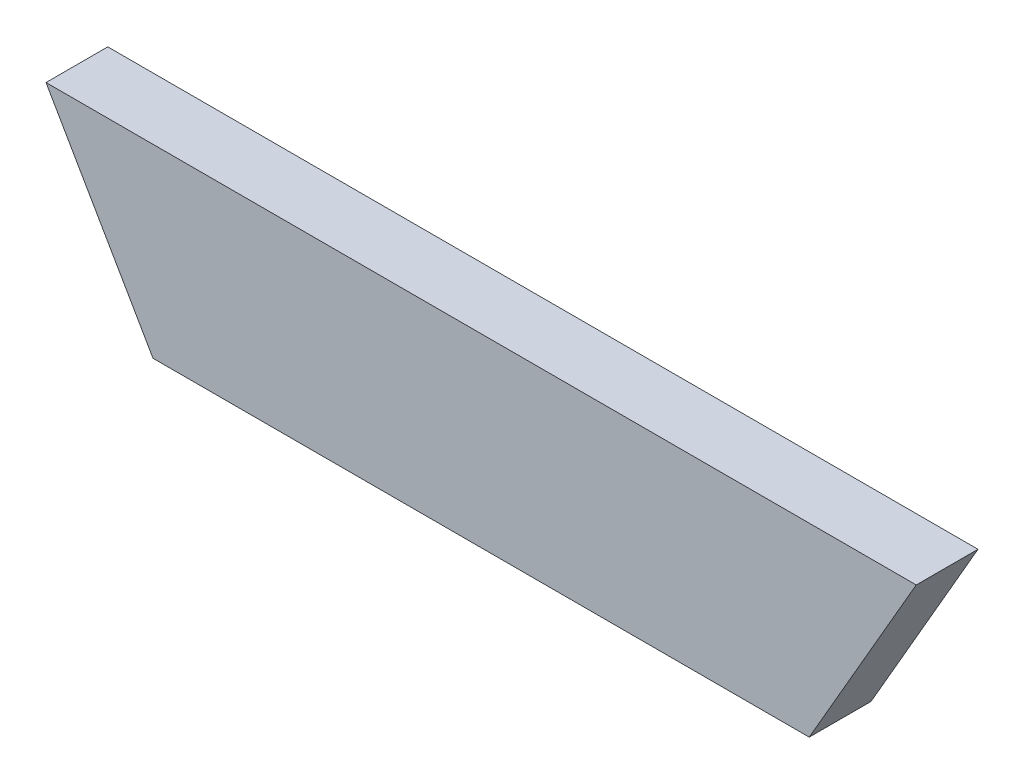
from build123d import *

# Parameters (mm, degrees)
BOSS_EXTRU_1_DEPTH = 15


with BuildPart() as part:
    # Esquisse1 → Boss.-Extru.1 (new body)
    with BuildSketch(Plane.XY):
        Polygon((-225.003085821, 84.109598527), (-13.683085821, 84.109598527), (-39.663847934, 39.109598527), (-199.022323707, 39.109598527), align=None)
    extrude(amount=BOSS_EXTRU_1_DEPTH)


solid = part.part
